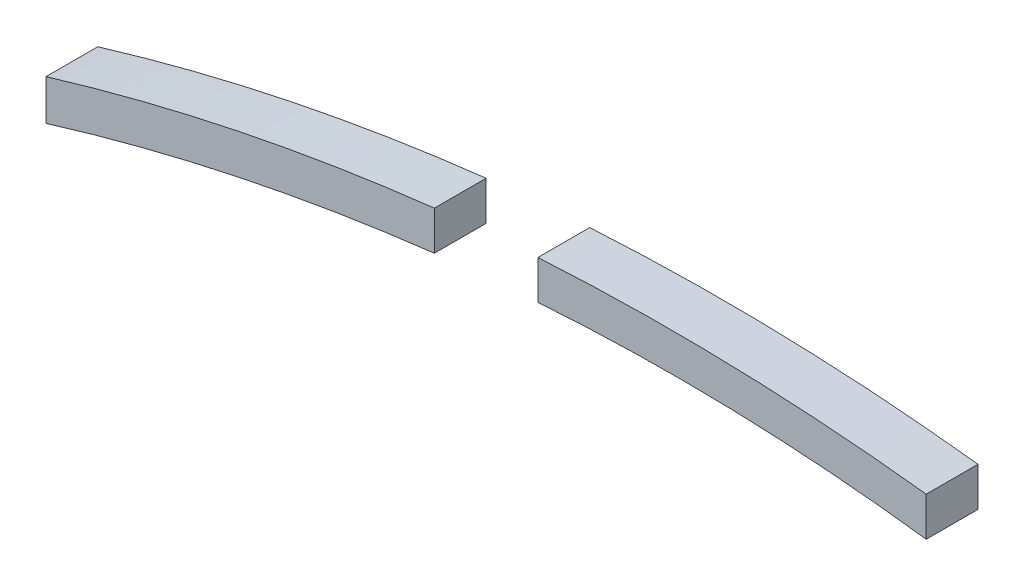
from build123d import *

# Parameters (mm, degrees)
BOSS_EXTRUDE1_DEPTH   = 2
BOSS_EXTRUDE1_2_DEPTH = 2


with BuildPart() as part:
    # Sketch2 → Boss-Extrude1 (new body)
    with BuildSketch(Plane.XY):
        with BuildLine():
            Line((-17, 16.700901097), (-17, 15.136036027))
            ThreePointArc((-17, 15.136036027), (-9.571516699, 17.053686668), (-2, 18.291379286))
            Line((-2, 18.291379286), (-2, 19.800878213))
            ThreePointArc((-2, 19.800878213), (-9.56969349, 18.58811871), (-17, 16.700901097))
        make_face()
    extrude(amount=BOSS_EXTRUDE1_DEPTH)


with BuildPart() as body_2:
    # Sketch2 → Boss-Extrude1 2 (new body)
    with BuildSketch(Plane.XY):
        with BuildLine():
            Line((17, 19.733107497), (17, 18.223903816))
            ThreePointArc((17, 18.223903816), (9.510555747, 18.809357716), (2, 18.647852762))
            Line((2, 18.647852762), (2, 20.15092203))
            ThreePointArc((2, 20.15092203), (9.509183289, 20.271704903), (17, 19.733107497))
        make_face()
    extrude(amount=BOSS_EXTRUDE1_2_DEPTH)


solid = Compound([part.part, body_2.part])
